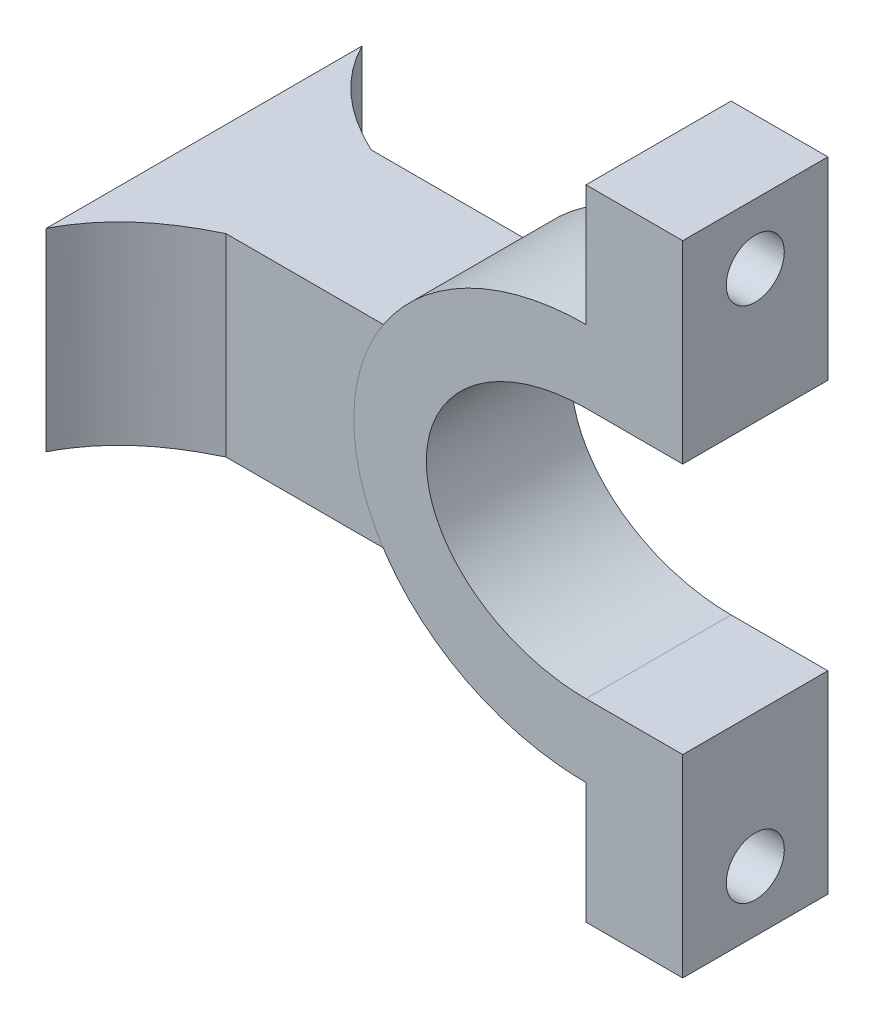
from build123d import *

# Parameters (mm, degrees)
BOSS_EXTRUDE1_DEPTH      = 15
BOSS_EXTRUDE2_DEPTH      = 5
BOSS_EXTRUDE2_DEPTH_BACK = 23
SKETCH2_W                = 15
SKETCH2_H                = 20
SKETCH3_W                = 15
SKETCH3_H                = 20
BOSS_EXTRUDE3_DEPTH      = 10
SKETCH4_R                = 3
CUT_EXTRUDE1_DEPTH       = 60.354865167
BOSS_EXTRUDE4_DEPTH      = 20


with BuildPart() as part:
    # Sketch1 → Boss-Extrude1 (new body)
    with BuildSketch(Plane.XY):
        with BuildLine():
            Line((0, 13), (0, 20.5))
            add(Edge.make_bspline(
                [(0, 20.5), (-24, 20.5), (-24, 0), (-24, -20.5), (0, -20.5)],
                knots=[1.570796327, 1.570796327, 1.570796327, 3.141592654, 3.141592654, 4.71238898, 4.71238898, 4.71238898], degree=2, weights=[1, 0.707106781, 1, 0.707106781, 1]))
            Line((0, -20.5), (0, -13))
            add(Edge.make_bspline(
                [(0, 13), (-16.5, 13), (-16.5, 0), (-16.5, -13), (0, -13)],
                knots=[1.570796327, 1.570796327, 1.570796327, 3.141592654, 3.141592654, 4.71238898, 4.71238898, 4.71238898], degree=2, weights=[1, 0.707106781, 1, 0.707106781, 1]))
        make_face()
    extrude(amount=BOSS_EXTRUDE1_DEPTH)

    # Sketch2 → Boss-Extrude2 (add, two sides: drawn at the far end of the back side and taken through both)
    with BuildSketch(Plane(origin=(-24, 0, 0), x_dir=(0, 0, -1), z_dir=(1, 0, 0)).offset(-BOSS_EXTRUDE2_DEPTH_BACK)):
        with Locations((-7.472665523, 0)):
            Rectangle(SKETCH2_W, SKETCH2_H)
    extrude(amount=BOSS_EXTRUDE2_DEPTH + BOSS_EXTRUDE2_DEPTH_BACK)

    # Sketch3 → Boss-Extrude3 (add)
    with BuildSketch(Plane(origin=(0, 0, 0), x_dir=(0, 0, -1), z_dir=(1, 0, 0))):
        with Locations((-7.5, 23)):
            Rectangle(SKETCH3_W, SKETCH3_H)
        with Locations((-7.5, -23)):
            Rectangle(SKETCH3_W, SKETCH3_H)
    extrude(amount=BOSS_EXTRUDE3_DEPTH)

    # Sketch4 → Cut-Extrude1 (cut, through all)
    with BuildSketch(Plane.ZY):
        with Locations(Location((7.5, 26.75, 0), (0, 0, 270))):
            Circle(SKETCH4_R)
        with Locations(Location((7.5, -26.75, 0), (0, 0, 90))):
            Circle(SKETCH4_R)
    extrude(amount=-CUT_EXTRUDE1_DEPTH, mode=Mode.SUBTRACT)

    # Sketch5 → Boss-Extrude4 (add)
    with BuildSketch(Plane.XZ.offset(10)):
        with BuildLine():
            Line((-47, 14.972665523), (-47, 23.794808984))
            add(Edge.make_bspline(
                [(-47, 23.794808984), (-44.414166481, 18.78156931), (-40.110917996, 16.372571745), (-37.23198846, 14.972665523)],
                knots=[0, 0, 0, 0, 1, 1, 1, 1], degree=3))
            Line((-37.23198846, 14.972665523), (-47, 14.972665523))
        make_face()
        with BuildLine():
            Line((-47, -0.027334477), (-47, -8.849477938))
            add(Edge.make_bspline(
                [(-47, -8.849477938), (-44.414166481, -3.836238264), (-40.110917996, -1.427240699), (-37.23198846, -0.027334477)],
                knots=[0, 0, 0, 0, 1, 1, 1, 1], degree=3))
            Line((-37.23198846, -0.027334477), (-47, -0.027334477))
        make_face()
    extrude(amount=-BOSS_EXTRUDE4_DEPTH)


solid = part.part
